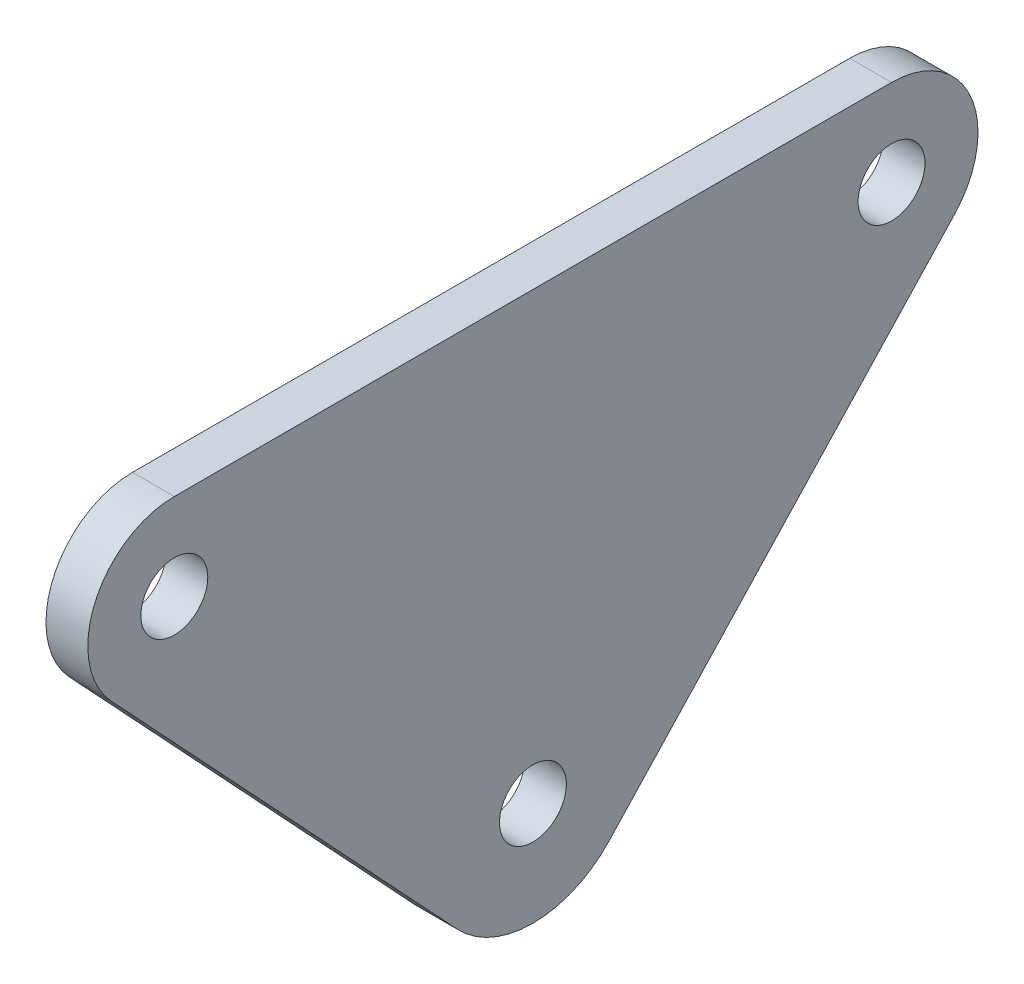
from build123d import *

# Parameters (mm, degrees)
SKETCH1_R           = 3.556
BOSS_EXTRUDE1_DEPTH = 4.445


with BuildPart() as part:
    # Sketch1 → Boss-Extrude1 (new body)
    with BuildSketch(Plane(origin=(0, 0, 0), x_dir=(0, 0, -1), z_dir=(1, 0, 0))):
        with BuildLine():
            Line((-38.1, 47.288805643), (38.1, 47.288805643))
            ThreePointArc((38.1, 47.288805643), (46.5280051, 41.760994289), (44.815753872, 31.828413352))
            Line((44.815753872, 31.828413352), (8.061763365, -7.528573627))
            ThreePointArc((8.061763365, -7.528573627), (0, -11.030478204), (-8.061763365, -7.528573627))
            Line((-8.061763365, -7.528573627), (-44.815753872, 31.828413352))
            ThreePointArc((-44.815753872, 31.828413352), (-46.5280051, 41.760994289), (-38.1, 47.288805643))
        make_face()
        with Locations((-38.1, 38.1)):
            Circle(SKETCH1_R, mode=Mode.SUBTRACT)
        Circle(SKETCH1_R, mode=Mode.SUBTRACT)
        with Locations((38.1, 38.1)):
            Circle(SKETCH1_R, mode=Mode.SUBTRACT)
    extrude(amount=BOSS_EXTRUDE1_DEPTH)


solid = part.part
